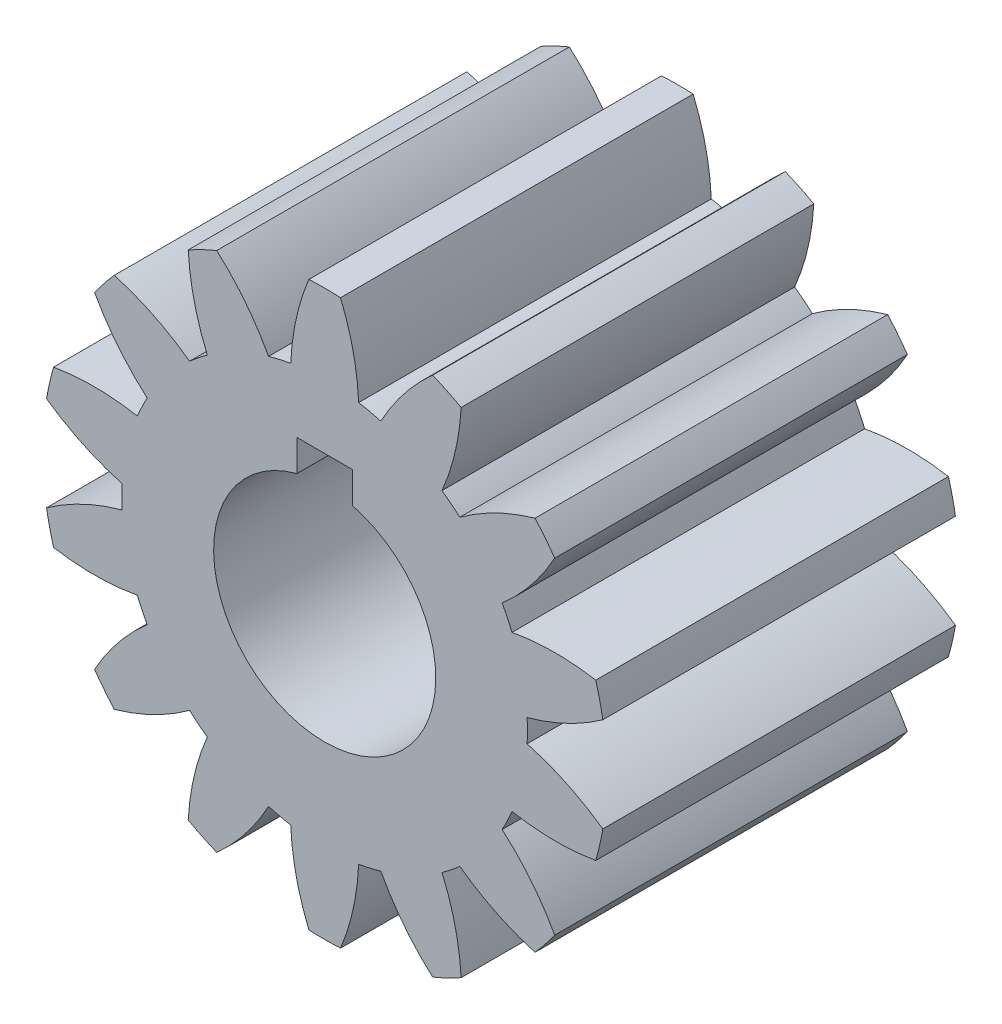
from build123d import *

# Parameters (mm, degrees)
BOSS_EXTRUDE1_DEPTH = 12.7


with BuildPart() as part:
    # Sketch1 → Boss-Extrude1 (new body)
    with BuildSketch(Plane.XY.offset(12.7)):
        with BuildLine():
            ThreePointArc((-4.914583893, 8.892269967), (-4.69950786, 7.393612219), (-4.22574714, 5.955633246))
            ThreePointArc((-4.22574714, 5.955633246), (-4.553034278, 5.709324401), (-4.865995885, 5.445051909))
            ThreePointArc((-4.865995885, 5.445051909), (-6.162500046, 6.226914882), (-7.575724395, 6.770081232))
            ThreePointArc((-7.575724395, 6.770081232), (-7.943407862, 6.334656387), (-8.286098429, 5.879300369))
            ThreePointArc((-8.286098429, 5.879300369), (-7.442078391, 4.622374388), (-6.391319038, 3.532357173))
            ThreePointArc((-6.391319038, 3.532357173), (-6.579325158, 3.168436005), (-6.746630286, 2.794545765))
            ThreePointArc((-6.746630286, 2.794545765), (-8.253977802, 2.93644789), (-9.762919991, 2.812648796))
            ThreePointArc((-9.762919991, 2.812648796), (-9.905267588, 2.260812689), (-10.016449548, 1.701863229))
            ThreePointArc((-10.016449548, 1.701863229), (-8.710654026, 0.93561862), (-7.291011817, 0.409454441))
            ThreePointArc((-7.291011817, 0.409454441), (-7.3025, 0), (-7.291011817, -0.409454441))
            ThreePointArc((-7.291011817, -0.409454441), (-8.710654026, -0.93561862), (-10.016449548, -1.701863229))
            ThreePointArc((-10.016449548, -1.701863229), (-9.905267588, -2.260812689), (-9.762919991, -2.812648796))
            ThreePointArc((-9.762919991, -2.812648796), (-8.253977802, -2.93644789), (-6.746630286, -2.794545765))
            ThreePointArc((-6.746630286, -2.794545765), (-6.579325158, -3.168436005), (-6.391319038, -3.532357173))
            ThreePointArc((-6.391319038, -3.532357173), (-7.442078391, -4.622374388), (-8.286098429, -5.879300369))
            ThreePointArc((-8.286098429, -5.879300369), (-7.943407862, -6.334656387), (-7.575724395, -6.770081232))
            ThreePointArc((-7.575724395, -6.770081232), (-6.162500046, -6.226914882), (-4.865995885, -5.445051909))
            ThreePointArc((-4.865995885, -5.445051909), (-4.553034278, -5.709324401), (-4.22574714, -5.955633246))
            ThreePointArc((-4.22574714, -5.955633246), (-4.69950786, -7.393612219), (-4.914583893, -8.892269967))
            ThreePointArc((-4.914583893, -8.892269967), (-4.408258789, -9.153843698), (-3.888063673, -9.38661605))
            ThreePointArc((-3.888063673, -9.38661605), (-2.850463577, -8.284065014), (-2.021591322, -7.017098744))
            ThreePointArc((-2.021591322, -7.017098744), (-1.62495912, -7.119411079), (-1.223214196, -7.199323113))
            ThreePointArc((-1.223214196, -7.199323113), (-1.026142161, -8.700454472), (-0.569675744, -10.144016441))
            ThreePointArc((-0.569675744, -10.144016441), (0, -10.16), (0.569675744, -10.144016441))
            ThreePointArc((0.569675744, -10.144016441), (1.026142161, -8.700454472), (1.223214196, -7.199323113))
            ThreePointArc((1.223214196, -7.199323113), (1.62495912, -7.119411079), (2.021591322, -7.017098744))
            ThreePointArc((2.021591322, -7.017098744), (2.850463577, -8.284065014), (3.888063673, -9.38661605))
            ThreePointArc((3.888063673, -9.38661605), (4.408258789, -9.153843698), (4.914583893, -8.892269967))
            ThreePointArc((4.914583893, -8.892269967), (4.69950786, -7.393612219), (4.22574714, -5.955633246))
            ThreePointArc((4.22574714, -5.955633246), (4.553034278, -5.709324401), (4.865995885, -5.445051909))
            ThreePointArc((4.865995885, -5.445051909), (6.162500046, -6.226914882), (7.575724395, -6.770081232))
            ThreePointArc((7.575724395, -6.770081232), (7.943407862, -6.334656387), (8.286098429, -5.879300369))
            ThreePointArc((8.286098429, -5.879300369), (7.442078391, -4.622374388), (6.391319038, -3.532357173))
            ThreePointArc((6.391319038, -3.532357173), (6.579325158, -3.168436005), (6.746630286, -2.794545765))
            ThreePointArc((6.746630286, -2.794545765), (8.253977802, -2.93644789), (9.762919991, -2.812648796))
            ThreePointArc((9.762919991, -2.812648796), (9.905267588, -2.260812689), (10.016449548, -1.701863229))
            ThreePointArc((10.016449548, -1.701863229), (8.710654026, -0.93561862), (7.291011817, -0.409454441))
            ThreePointArc((7.291011817, -0.409454441), (7.3025, 0), (7.291011817, 0.409454441))
            ThreePointArc((7.291011817, 0.409454441), (8.710654026, 0.93561862), (10.016449548, 1.701863229))
            ThreePointArc((10.016449548, 1.701863229), (9.905267588, 2.260812689), (9.762919991, 2.812648796))
            ThreePointArc((9.762919991, 2.812648796), (8.253977802, 2.93644789), (6.746630286, 2.794545765))
            ThreePointArc((6.746630286, 2.794545765), (6.579325158, 3.168436005), (6.391319038, 3.532357173))
            ThreePointArc((6.391319038, 3.532357173), (7.442078391, 4.622374388), (8.286098429, 5.879300369))
            ThreePointArc((8.286098429, 5.879300369), (7.943407862, 6.334656387), (7.575724395, 6.770081232))
            ThreePointArc((7.575724395, 6.770081232), (6.162500046, 6.226914882), (4.865995885, 5.445051909))
            ThreePointArc((4.865995885, 5.445051909), (4.553034278, 5.709324401), (4.22574714, 5.955633246))
            ThreePointArc((4.22574714, 5.955633246), (4.69950786, 7.393612219), (4.914583893, 8.892269967))
            ThreePointArc((4.914583893, 8.892269967), (4.408258789, 9.153843698), (3.888063673, 9.38661605))
            ThreePointArc((3.888063673, 9.38661605), (2.850463577, 8.284065014), (2.021591322, 7.017098744))
            ThreePointArc((2.021591322, 7.017098744), (1.62495912, 7.119411079), (1.223214196, 7.199323113))
            ThreePointArc((1.223214196, 7.199323113), (1.026142161, 8.700454472), (0.569675744, 10.144016441))
            ThreePointArc((0.569675744, 10.144016441), (0, 10.16), (-0.569675744, 10.144016441))
            ThreePointArc((-0.569675744, 10.144016441), (-1.026142161, 8.700454472), (-1.223214196, 7.199323113))
            ThreePointArc((-1.223214196, 7.199323113), (-1.62495912, 7.119411079), (-2.021591322, 7.017098744))
            ThreePointArc((-2.021591322, 7.017098744), (-2.850463577, 8.284065014), (-3.888063673, 9.38661605))
            ThreePointArc((-3.888063673, 9.38661605), (-4.408258789, 9.153843698), (-4.914583893, 8.892269967))
        make_face()
        with BuildLine():
            Line((-1, 3.872983346), (-1, 5))
            Line((-1, 5), (1, 5))
            Line((1, 5), (1, 3.872983346))
            ThreePointArc((1, 3.872983346), (0, -4), (-1, 3.872983346))
        make_face(mode=Mode.SUBTRACT)
    extrude(amount=-BOSS_EXTRUDE1_DEPTH)


solid = part.part
